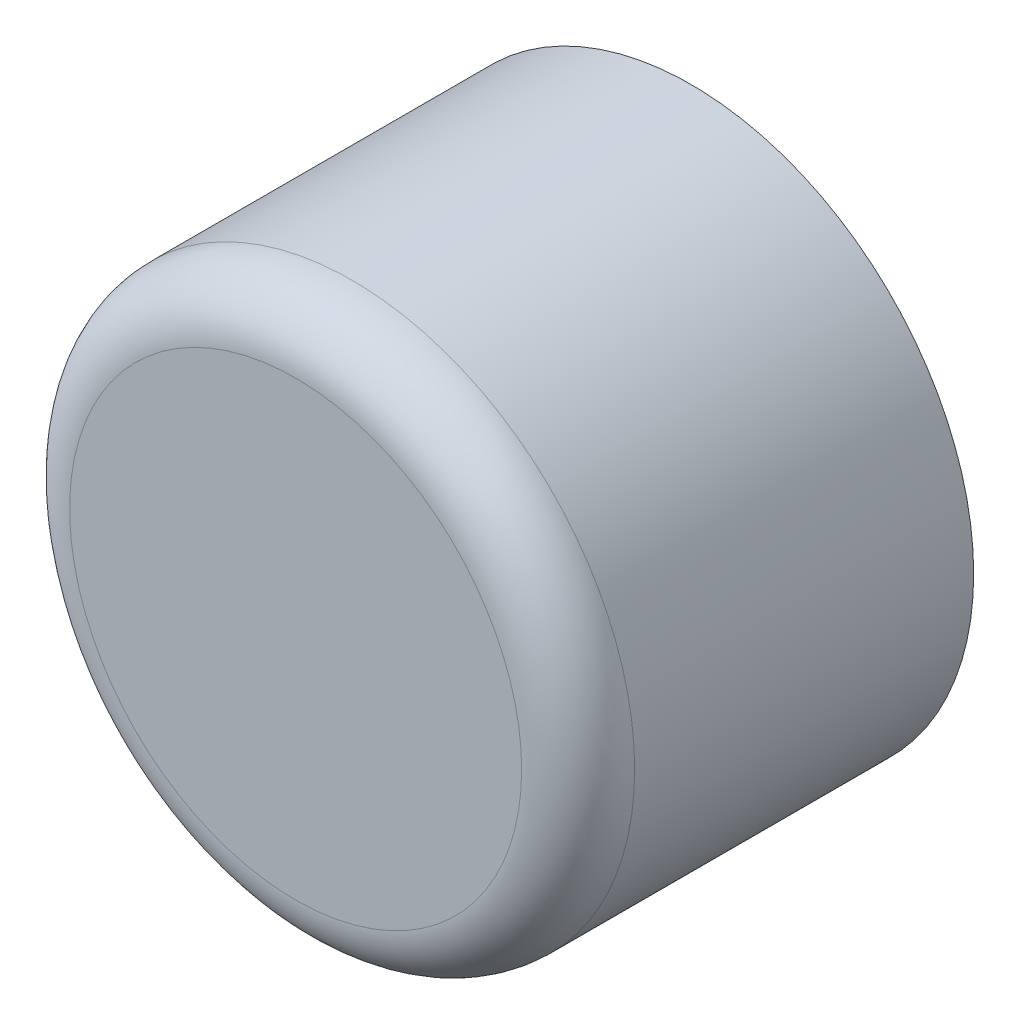
from build123d import *

# Parameters (mm, degrees)
SKETCH3_R           = 5
BOSS_EXTRUDE2_DEPTH = 5
BOSS_EXTRUDE3_START = 2
SKETCH4_R           = 5
BOSS_EXTRUDE3_DEPTH = 2
SKETCH5_W           = 3.7592
SKETCH5_H           = 2
CUT_EXTRUDE2_DEPTH  = 0.5
SKETCH6_W           = 3.7592
SKETCH6_H           = 2
CUT_EXTRUDE3_DEPTH  = 0.5
SKETCH7_W           = 2
SKETCH7_H           = 4.7592
CUT_EXTRUDE4_DEPTH  = 0.5
SKETCH8_W           = 2
SKETCH8_H           = 4.7592
CUT_EXTRUDE5_DEPTH  = 0.5
FILLET1_R           = 1


with BuildPart() as part:
    # Sketch3 → Boss-Extrude2 (new body)
    with BuildSketch(Plane.XY.offset(2.9718)):
        with Locations((30.41838411, -58.09837557)):
            Circle(SKETCH3_R)
    extrude(amount=BOSS_EXTRUDE2_DEPTH)

    # Sketch4 → Boss-Extrude3 (add)
    with BuildSketch(Plane(origin=(0, 0, 2.9718), x_dir=(-1, 0, 0), z_dir=(0, 0, -1)).offset(BOSS_EXTRUDE3_START)):
        with Locations((-30.41838411, -58.09837557)):
            Circle(SKETCH4_R)
        Polygon((-30.505343509, -60.755108598), (-33.075117138, -58.011416171), (-30.331424712, -55.441642541), (-27.761651082, -58.185334968), align=None, mode=Mode.SUBTRACT)
    extrude(amount=-BOSS_EXTRUDE3_DEPTH)

    # Sketch5 → Cut-Extrude2 (cut)
    with BuildSketch(Plane(origin=(-13.487510975, -14.400327439, 0), x_dir=(0.7298607220838652, -0.6835958794194263, 0), z_dir=(-0.6835958794194263, -0.7298607220838652, 0))):
        with Locations((61.916993932, 1.9718)):
            Rectangle(SKETCH5_W, SKETCH5_H)
    extrude(amount=-CUT_EXTRUDE2_DEPTH, mode=Mode.SUBTRACT)

    # Sketch6 → Cut-Extrude3 (cut)
    with BuildSketch(Plane(origin=(-16.057284605, -17.144019865, 0), x_dir=(0.7298607220838642, -0.6835958794194275, 0), z_dir=(0.6835958794194275, 0.7298607220838642, 0))):
        with Locations((61.916993932, -1.9718)):
            Rectangle(SKETCH6_W, SKETCH6_H)
    extrude(amount=-CUT_EXTRUDE3_DEPTH, mode=Mode.SUBTRACT)

    # Sketch7 → Cut-Extrude4 (cut)
    with BuildSketch(Plane(origin=(43.818935687, -41.041315103, 0), x_dir=(0, 0, -1), z_dir=(0.7298607220838652, -0.6835958794194263, 0))):
        with Locations((-1.9718, -21.609840309)):
            Rectangle(SKETCH7_W, SKETCH7_H)
    extrude(amount=-CUT_EXTRUDE4_DEPTH, mode=Mode.SUBTRACT)

    # Sketch8 → Cut-Extrude5 (cut)
    with BuildSketch(Plane(origin=(46.562628114, -43.611088733, 0), x_dir=(0, 0, 1), z_dir=(-0.7298607220838662, 0.6835958794194253, 0))):
        with Locations((1.9718, -21.609840309)):
            Rectangle(SKETCH8_W, SKETCH8_H)
    extrude(amount=-CUT_EXTRUDE5_DEPTH, mode=Mode.SUBTRACT)

    # Fillet1
    fillet1_edges = [part.edges().sort_by_distance(p)[0] for p in [
        (25.41838411, -58.09837557, 7.9718),
    ]]
    fillet(fillet1_edges, radius=FILLET1_R)


solid = part.part
